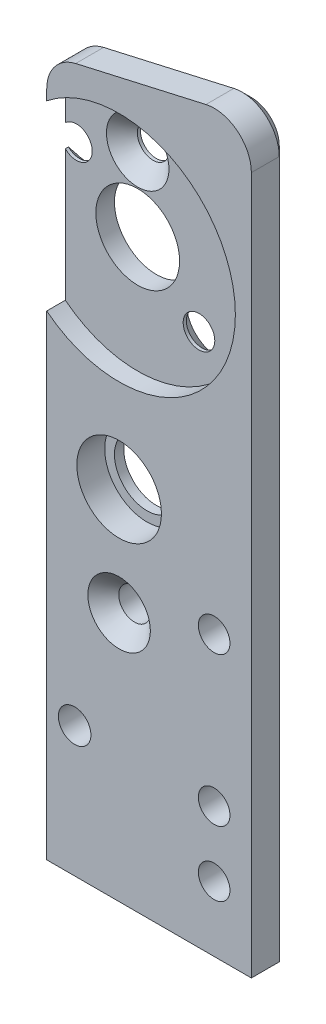
from build123d import *

# Parameters (mm, degrees)
RESSALTO_EXTRUS_O1_DEPTH                             = 4
FILETE1_R                                            = 4
CHANFRO1_SIZE                                        = 1
FURO_DE_DI_METRO_7_0_7_1_D                           = 7
ESCAREADO_PARA_PARAFUSO_COM_CABE_A_ESCAR_D           = 3.4
ESCAREADO_PARA_PARAFUSO_COM_CABE_A_ESCAR_CSINK_D     = 6.3
ESCAREADO_PARA_PARAFUSO_COM_CABE_A_ESCAR_CSINK_ANGLE = 90
BROCA_DE_ROSQUEAR_PARA_TARRAXA_DE_M21_D              = 1.6
BROCA_DE_ROSQUEAR_PARA_TARRAXA_DE_M21_DEPTH          = 8
BROCA_DE_ROSQUEAR_PARA_TARRAXA_DE_M21_TIP            = 0.480688495
FURO_DE_DI_METRO_9_0_9_3_D                           = 9
ESCAREADO_PARA_PARAFUSO_ALLEN_SEXTAVADO_D            = 3.4
ESCAREADO_PARA_PARAFUSO_ALLEN_SEXTAVADO_CSINK_D      = 6.72
ESCAREADO_PARA_PARAFUSO_ALLEN_SEXTAVADO_CSINK_ANGLE  = 90
ESCAREADO_PARA_PARAFUSO_COM_CABE_A_E_2_D             = 3.4
ESCAREADO_PARA_PARAFUSO_COM_CABE_A_E_2_DEPTH         = 4
ESCAREADO_PARA_PARAFUSO_COM_CABE_A_E_2_CSINK_D       = 6.3
ESCAREADO_PARA_PARAFUSO_COM_CABE_A_E_2_CSINK_ANGLE   = 90
ESCAREADO_PARA_PARAFUSO_COM_CABE_A_E_2_TIP           = 1.021463052
ESBO_O12_R                                           = 4.55
CORTE_EXTRUS_O1_DEPTH                                = 3
FURO_DE_DI_METRO_3_5_3_5_1_D                         = 3.5
ESBO_O36_R                                           = 12.5
CORTE_EXTRUS_O4_DEPTH                                = 2
ESCAREADO_PARA_PARAFUSO_ALLEN_SEXTAV_2_D             = 3.4
ESCAREADO_PARA_PARAFUSO_ALLEN_SEXTAV_2_CSINK_D       = 6.72
ESCAREADO_PARA_PARAFUSO_ALLEN_SEXTAV_2_CSINK_ANGLE   = 90
ESCAREADO_PARA_PARAFUSO_ALLEN_SEXTAV_2_O_D           = 3.4
ESCAREADO_PARA_PARAFUSO_ALLEN_SEXTAV_2_O_CSINK_D     = 6.72
ESCAREADO_PARA_PARAFUSO_ALLEN_SEXTAV_2_O_CSINK_ANGLE = 90


with BuildPart() as part:
    # Esboço1 → Ressalto-extrusão1 (new body)
    with BuildSketch(Plane.XY):
        Polygon((0, 0), (22, 0), (22, 80), (0, 75), align=None)
    extrude(amount=RESSALTO_EXTRUS_O1_DEPTH)

    # Filete1
    filete1_edges = [part.edges().sort_by_distance(p)[0] for p in [
        (0, 75, 2),
        (22, 80, 2),
    ]]
    fillet(filete1_edges, radius=FILETE1_R)

    # Chanfro1
    chanfro1_edges = [part.edges().sort_by_distance(p)[0] for p in [
        (10.113515586, 77.298526269, 0),
        (0, 35.903542878, 0),
        (0.873825208, 74.302487761, 0),
        (20.495402006, 78.115078729, 0),
        (22, 37.494451969, 0),
    ]]
    chamfer(chanfro1_edges, length=CHANFRO1_SIZE)

    # Furo de diâmetro Ø7.0 (7)1 (through all)
    with Locations(Plane(origin=(7.780869527, 38.393713373, 0), x_dir=(-1, 0, 0), z_dir=(0, 0, -1))):
        with Locations((0, 0)):
            Hole(FURO_DE_DI_METRO_7_0_7_1_D / 2)

    # Escareado para parafuso com cabe_a escar (through all)
    with Locations(Plane(origin=(18, 7, 0), x_dir=(-1, 0, 0), z_dir=(0, 0, -1))):
        with Locations((0, 0), (0, 7)):
            CounterSinkHole(ESCAREADO_PARA_PARAFUSO_COM_CABE_A_ESCAR_D / 2, ESCAREADO_PARA_PARAFUSO_COM_CABE_A_ESCAR_CSINK_D / 2, counter_sink_angle=ESCAREADO_PARA_PARAFUSO_COM_CABE_A_ESCAR_CSINK_ANGLE)

    # Broca de rosquear para tarraxa de M21
    with Locations(Plane(origin=(4, 0, 2), x_dir=(0, 0, -1), z_dir=(0, -1, 0))):
        with Locations((0, 0), (0, 8)):
            Hole(BROCA_DE_ROSQUEAR_PARA_TARRAXA_DE_M21_D / 2, depth=BROCA_DE_ROSQUEAR_PARA_TARRAXA_DE_M21_DEPTH)
            with Locations((0, 0, -(BROCA_DE_ROSQUEAR_PARA_TARRAXA_DE_M21_DEPTH + BROCA_DE_ROSQUEAR_PARA_TARRAXA_DE_M21_TIP / 2))):  # 118° drill point
                Cone(0, BROCA_DE_ROSQUEAR_PARA_TARRAXA_DE_M21_D / 2, BROCA_DE_ROSQUEAR_PARA_TARRAXA_DE_M21_TIP, mode=Mode.SUBTRACT)

    # Furo de diâmetro Ø9.0 (9)3 (through all)
    with Locations(Plane(origin=(7.780869527, 60.893713373, 0), x_dir=(-1, 0, 0), z_dir=(0, 0, -1))):
        with Locations((0, 0)):
            Hole(FURO_DE_DI_METRO_9_0_9_3_D / 2)

    # Escareado para parafuso Allen sextavado (through all)
    with Locations(Plane(origin=(14.368851738, 55.36573993, 0), x_dir=(-1, 0, 0), z_dir=(0, 0, -1))):
        with Locations((0, 0), (13.175964422, 11.055946886)):
            CounterSinkHole(ESCAREADO_PARA_PARAFUSO_ALLEN_SEXTAVADO_D / 2, ESCAREADO_PARA_PARAFUSO_ALLEN_SEXTAVADO_CSINK_D / 2, counter_sink_angle=ESCAREADO_PARA_PARAFUSO_ALLEN_SEXTAVADO_CSINK_ANGLE)

    # Escareado para parafuso com cabe_a e 2
    with Locations(Plane(origin=(18, 30, 0), x_dir=(-1, 0, 0), z_dir=(0, 0, -1))):
        with Locations((0, 0)):
            CounterSinkHole(ESCAREADO_PARA_PARAFUSO_COM_CABE_A_E_2_D / 2, ESCAREADO_PARA_PARAFUSO_COM_CABE_A_E_2_CSINK_D / 2, depth=ESCAREADO_PARA_PARAFUSO_COM_CABE_A_E_2_DEPTH, counter_sink_angle=ESCAREADO_PARA_PARAFUSO_COM_CABE_A_E_2_CSINK_ANGLE)
            with Locations((0, 0, -(ESCAREADO_PARA_PARAFUSO_COM_CABE_A_E_2_DEPTH + ESCAREADO_PARA_PARAFUSO_COM_CABE_A_E_2_TIP / 2))):  # 118° drill point
                Cone(0, ESCAREADO_PARA_PARAFUSO_COM_CABE_A_E_2_D / 2, ESCAREADO_PARA_PARAFUSO_COM_CABE_A_E_2_TIP, mode=Mode.SUBTRACT)

    # Esboço12 → Corte-extrusão1 (cut)
    with BuildSketch(Plane.XY.offset(4)):
        with Locations((7.780869527, 38.393713373)):
            Circle(ESBO_O12_R)
    extrude(amount=-CORTE_EXTRUS_O1_DEPTH, mode=Mode.SUBTRACT)

    # Furo de diâmetro Ø3.5 (3.5)1 (through all)
    with Locations(Plane(origin=(3, 14, 0), x_dir=(-1, 0, 0), z_dir=(0, 0, -1))):
        with Locations((0, 0)):
            Hole(FURO_DE_DI_METRO_3_5_3_5_1_D / 2)

    # Esboço36 → Corte-extrusão4 (cut)
    with BuildSketch(Plane.XY.offset(4)):
        with Locations((7.780869527, 60.893713373)):
            Circle(ESBO_O36_R)
    extrude(amount=-CORTE_EXTRUS_O4_DEPTH, mode=Mode.SUBTRACT)

    # Escareado para parafuso Allen sextav 2 (through all)
    with Locations(Plane(origin=(7.780869527, 26.893713373, 4), x_dir=(1, 0, 0), z_dir=(0, 0, 1))):
        with Locations((0, 0)):
            CounterSinkHole(ESCAREADO_PARA_PARAFUSO_ALLEN_SEXTAV_2_D / 2, ESCAREADO_PARA_PARAFUSO_ALLEN_SEXTAV_2_CSINK_D / 2, counter_sink_angle=ESCAREADO_PARA_PARAFUSO_ALLEN_SEXTAV_2_CSINK_ANGLE)

    # Escareado para parafuso Allen sextav 2 o (through all)
    with Locations(Plane(origin=(7.780869527, 68.893713373, 2), x_dir=(1, 0, 0), z_dir=(0, 0, 1))):
        with Locations((0, 0)):
            CounterSinkHole(ESCAREADO_PARA_PARAFUSO_ALLEN_SEXTAV_2_O_D / 2, ESCAREADO_PARA_PARAFUSO_ALLEN_SEXTAV_2_O_CSINK_D / 2, counter_sink_angle=ESCAREADO_PARA_PARAFUSO_ALLEN_SEXTAV_2_O_CSINK_ANGLE)


solid = part.part
